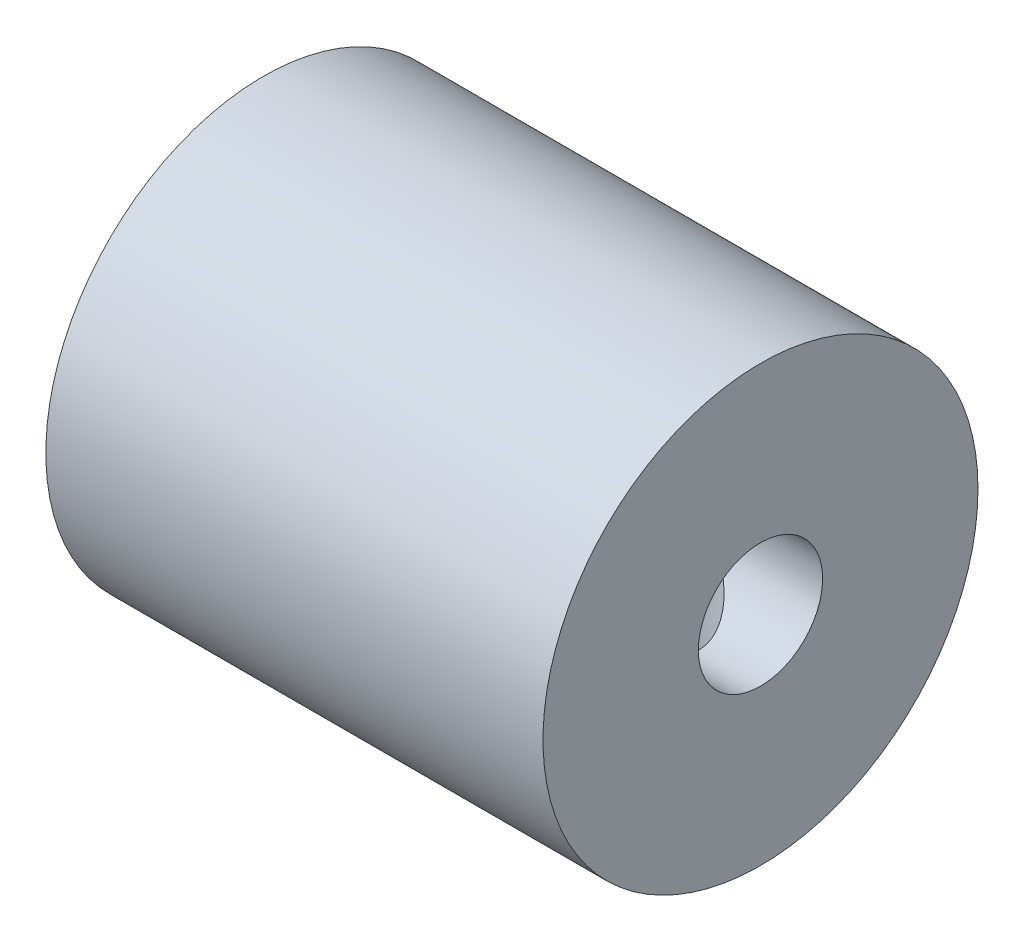
from build123d import *

# Parameters (mm, degrees)
SKETCH1_W         = 25.4
SKETCH1_H         = 11.1125
HOLE1_D           = 6.35
HOLE1_CBORE_D     = 11.1125
HOLE1_CBORE_DEPTH = 12.7
SKETCH4_W         = 3.175
SKETCH4_H         = 11.1125
HOLE3_D           = 6.35
HOLE3_DEPTH       = 6.552753399


with BuildPart() as part:
    # Sketch1 → Revolve1 (revolve)
    with BuildSketch(Plane.XY):
        with Locations((0, 5.55625)):
            Rectangle(SKETCH1_W, SKETCH1_H)
    revolve(axis=Axis((-12.7, 0, 0), (1, 0, 0)))

    # Hole1 (through all)
    with Locations(Plane.ZY.offset(12.7)):
        with Locations((0, 0)):
            CounterBoreHole(HOLE1_D / 2, HOLE1_CBORE_D / 2, HOLE1_CBORE_DEPTH)

    # Sketch4 → Hole2 (revolve, cut)
    with BuildSketch(Plane(origin=(6.35, 0, 0), x_dir=(0, 0, 1), z_dir=(1, 0, 0))):
        with Locations((1.5875, 5.55625)):
            Rectangle(SKETCH4_W, SKETCH4_H)
    revolve(axis=Axis((6.35, -110, 0), (0, 1, 0)), mode=Mode.SUBTRACT)

    # Hole3
    with Locations(Plane(origin=(0, -4.559746601, 0), x_dir=(1, 0, 0), z_dir=(0, 1, 0))):
        with Locations((-6.35, 0)):
            Hole(HOLE3_D / 2, depth=HOLE3_DEPTH)


solid = part.part
